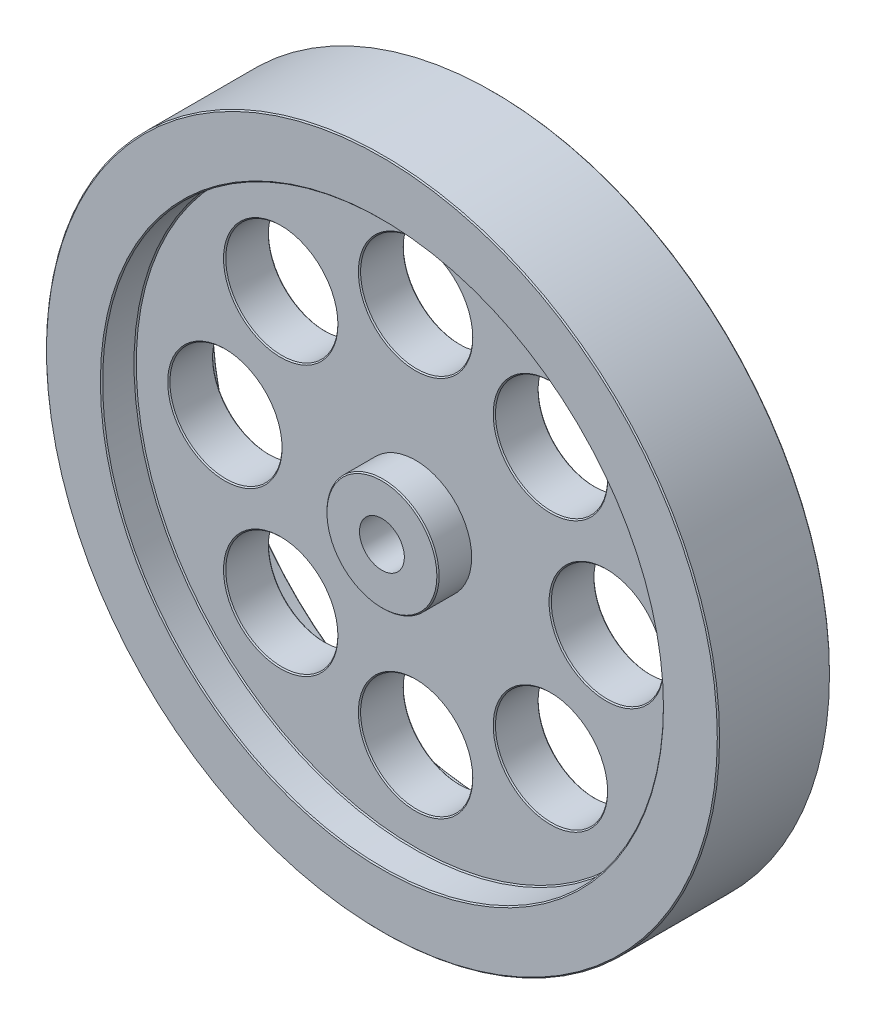
from build123d import *

# Parameters (mm, degrees)
SKETCH2_R           = 30
BOSS_EXTRUDE2_DEPTH = 5
SKETCH3_R           = 25
SKETCH3_R_2         = 5
CUT_EXTRUDE1_DEPTH  = 3
SKETCH4_R           = 5
CUT_EXTRUDE2_DEPTH  = 44
CHAMFER1_SIZE       = 0.1


with BuildPart() as part:
    # Sketch2 → Boss-Extrude2 (new, symmetric)
    with BuildSketch(Plane.XY):
        Circle(SKETCH2_R)
    extrude(amount=BOSS_EXTRUDE2_DEPTH, both=True)

    # Sketch3 → Cut-Extrude1 (cut)
    with BuildSketch(Plane.XY.offset(5)):
        Circle(SKETCH3_R)
        Circle(SKETCH3_R_2, mode=Mode.SUBTRACT)
    cut_extrude1 = extrude(amount=-CUT_EXTRUDE1_DEPTH, mode=Mode.SUBTRACT)

    # Mirror1: Cut-Extrude1 across plane
    add(cut_extrude1.mirror(Plane.XY), mode=Mode.SUBTRACT)

    # Sketch4 → Cut-Extrude2 (cut, through all)
    with BuildSketch(Plane.XY.offset(2)):
        with Locations((0, 17)):
            Circle(SKETCH4_R)
        with Locations((12.02081528, 12.02081528)):
            Circle(SKETCH4_R)
        with Locations((17, 0)):
            Circle(SKETCH4_R)
        with Locations((12.02081528, -12.02081528)):
            Circle(SKETCH4_R)
        with Locations((0, -17)):
            Circle(SKETCH4_R)
        with Locations((-12.02081528, -12.02081528)):
            Circle(SKETCH4_R)
        with Locations((-17, 0)):
            Circle(SKETCH4_R)
        with Locations((-12.02081528, 12.02081528)):
            Circle(SKETCH4_R)
    extrude(amount=-CUT_EXTRUDE2_DEPTH, mode=Mode.SUBTRACT)

    # Chamfer1
    chamfer1_edges = [part.edges().sort_by_distance(p)[0] for p in [
        (-25, 0, -2),
        (-5, 0, -5),
        (-25, 0, -5),
        (-30, 0, -5),
        (-17.02081528, 12.02081528, -2),
        (-17.02081528, 12.02081528, 2),
        (-22, 0, -2),
        (-22, 0, 2),
        (-17.02081528, -12.02081528, -2),
        (-17.02081528, -12.02081528, 2),
        (-5, -17, -2),
        (-5, -17, 2),
        (7.02081528, -12.02081528, -2),
        (7.02081528, -12.02081528, 2),
        (12, 0, -2),
        (12, 0, 2),
        (7.02081528, 12.02081528, -2),
        (7.02081528, 12.02081528, 2),
        (-5, 17, -2),
        (-5, 17, 2),
        (-30, 0, 5),
        (-25, 0, 2),
        (-25, 0, 5),
        (-5, 0, 5),
    ]]
    chamfer(chamfer1_edges, length=CHAMFER1_SIZE)

    # Sketch8 → Cut-Revolve1 (revolve, cut)
    with BuildSketch(Plane(origin=(0, 0, 0), x_dir=(0, 0, -1), z_dir=(1, 0, 0))):
        Polygon((-5, 0), (-5, 2), (1, 2), (1, 1.5), (3.5, 1.5), (5, 3), (5, 0), align=None)
    revolve(axis=Axis((0, 0, -5), (0, 0, 1)), mode=Mode.SUBTRACT)


solid = part.part
